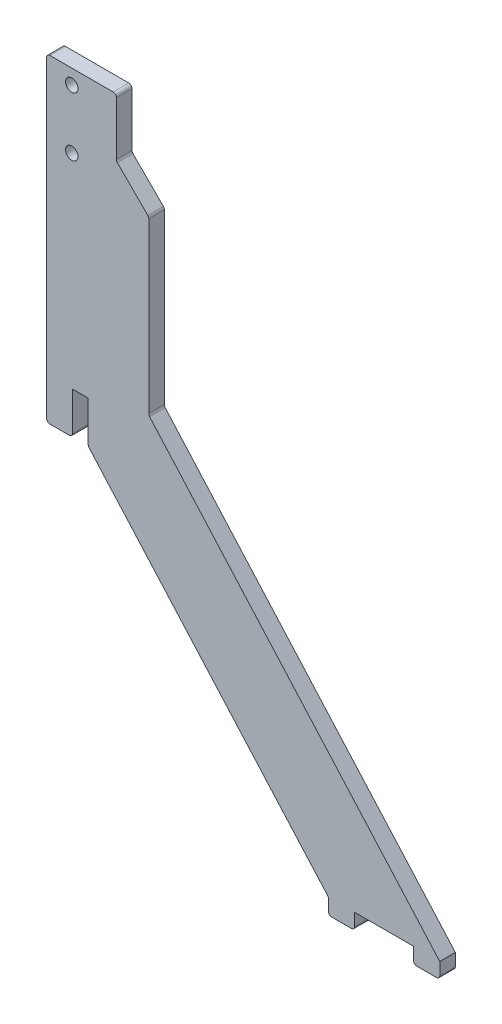
from build123d import *

# Parameters (mm, degrees)
SKETCH1_R           = 1.89865
BOSS_EXTRUDE1_DEPTH = 4.7625


with BuildPart() as part:
    # Sketch1 → Boss-Extrude1 (new body)
    with BuildSketch(Plane.XY):
        with BuildLine():
            Line((-2.175, 27), (17.118365096, 27))
            ThreePointArc((17.118365096, 27), (17.825471878, 26.707106781), (18.118365096, 26))
            Line((18.118365096, 26), (18.118365096, 9.664213562))
            ThreePointArc((18.118365096, 9.664213562), (18.194485564, 9.28153013), (18.411258315, 8.957106781))
            Line((18.411258315, 8.957106781), (27.707106781, -0.338741685))
            ThreePointArc((27.707106781, -0.338741685), (27.923879533, -0.663165034), (28, -1.045848466))
            Line((28, -1.045848466), (28, -52.620004972))
            ThreePointArc((28, -52.620004972), (28.065214876, -52.975218671), (28.252353545, -53.284101936))
            Line((28.252353545, -53.284101936), (116.825, -153))
            Line((116.825, -153), (116.825, -156.7625))
            ThreePointArc((116.825, -156.7625), (116.532106781, -157.469606781), (115.825, -157.7625))
            Line((115.825, -157.7625), (109.825, -157.7625))
            ThreePointArc((109.825, -157.7625), (109.117893219, -157.469606781), (108.825, -156.7625))
            Line((108.825, -156.7625), (108.825, -153))
            Line((108.825, -153), (90.851723172, -153))
            Line((90.851723172, -153), (90.851723172, -156.7625))
            ThreePointArc((90.851723172, -156.7625), (90.558829954, -157.469606781), (89.851723172, -157.7625))
            Line((89.851723172, -157.7625), (83.851723172, -157.7625))
            ThreePointArc((83.851723172, -157.7625), (83.144616391, -157.469606781), (82.851723172, -156.7625))
            Line((82.851723172, -156.7625), (82.851723172, -153))
            Line((82.851723172, -153), (9.777353545, -70.73220419))
            ThreePointArc((9.777353545, -70.73220419), (9.590214876, -70.423320926), (9.525, -70.068107226))
            Line((9.525, -70.068107226), (9.525, -57.748102255))
            Line((9.525, -57.748102255), (4.7625, -57.748102255))
            Line((4.7625, -57.748102255), (4.7625, -69.448102255))
            ThreePointArc((4.7625, -69.448102255), (4.469606781, -70.155209036), (3.7625, -70.448102255))
            Line((3.7625, -70.448102255), (-2.175, -70.448102255))
            ThreePointArc((-2.175, -70.448102255), (-2.882106781, -70.155209036), (-3.175, -69.448102255))
            Line((-3.175, -69.448102255), (-3.175, 26))
            ThreePointArc((-3.175, 26), (-2.882106781, 26.707106781), (-2.175, 27))
        make_face()
        with Locations(Location((4.5, 22.5, 0), (0, 0, 180))):
            Circle(SKETCH1_R, mode=Mode.SUBTRACT)
        with Locations(Location((4.5, 4.5, 0), (0, 0, 180))):
            Circle(SKETCH1_R, mode=Mode.SUBTRACT)
    extrude(amount=BOSS_EXTRUDE1_DEPTH)


solid = part.part
